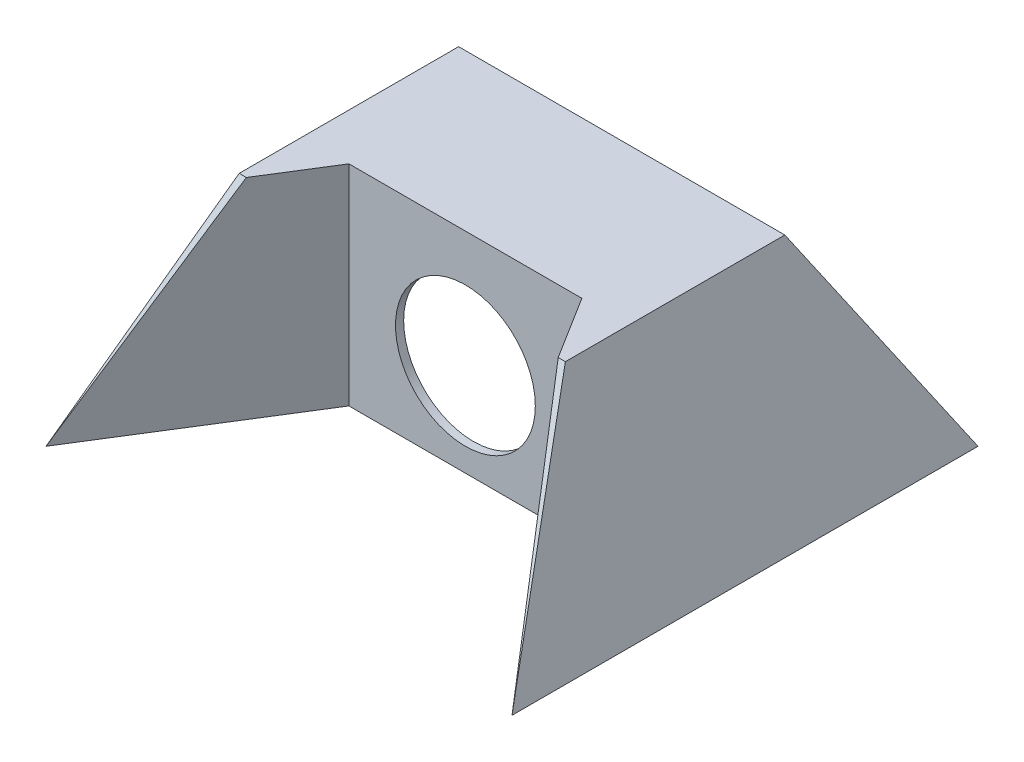
from build123d import *

# Parameters (mm, degrees)
GRUNDK_RPER_DEPTH               = 100
SCHRAEGEN_VORNE_DEPTH           = 100
SCHNITT_LINEAR_AUSTRAGEN4_DEPTH = 45
WANDUNG3_T                      = -1.75
SKIZZE6_R                       = 15
SCHNITT_LINEAR_AUSTRAGEN6_DEPTH = 2


with BuildPart() as part:
    # Skizze1 → Grundkörper (new body)
    with BuildSketch(Plane.XY):
        Polygon((0, 0), (100, 0), (85, 45), (15, 45), align=None)
    extrude(amount=-GRUNDK_RPER_DEPTH)

    # Skizze2 → Schraegen_vorne (cut)
    with BuildSketch(Plane(origin=(0, 0, 0), x_dir=(0, 0, -1), z_dir=(1, 0, 0))):
        Polygon((100, 0), (73.544212344, 45), (100, 45), align=None)
    schraegen_vorne = extrude(amount=SCHRAEGEN_VORNE_DEPTH, mode=Mode.SUBTRACT)

    # Spiegel_Schraege_hinten: Schraegen_vorne across plane
    add(schraegen_vorne.mirror(Plane.XY.offset(-50)), mode=Mode.SUBTRACT)

    # Skizze4 → Schnitt-Linear austragen4 (cut)
    with BuildSketch(Plane.XZ):
        Polygon((100, 0), (75, -40), (25, -40), (0, 0), align=None)
    extrude(amount=-SCHNITT_LINEAR_AUSTRAGEN4_DEPTH, mode=Mode.SUBTRACT)

    # Wandung3
    wandung3_openings = [part.faces().sort_by_distance(p)[0] for p in [
        (50, 0, -63.80952381),
    ]]
    offset(amount=WANDUNG3_T, openings=wandung3_openings, kind=Kind.INTERSECTION)

    # Skizze6 → Schnitt-Linear austragen6 (cut)
    with BuildSketch(Plane.XY.offset(-40)):
        with Locations((50, 20)):
            Circle(SKIZZE6_R)
    extrude(amount=-SCHNITT_LINEAR_AUSTRAGEN6_DEPTH, mode=Mode.SUBTRACT)


solid = part.part
